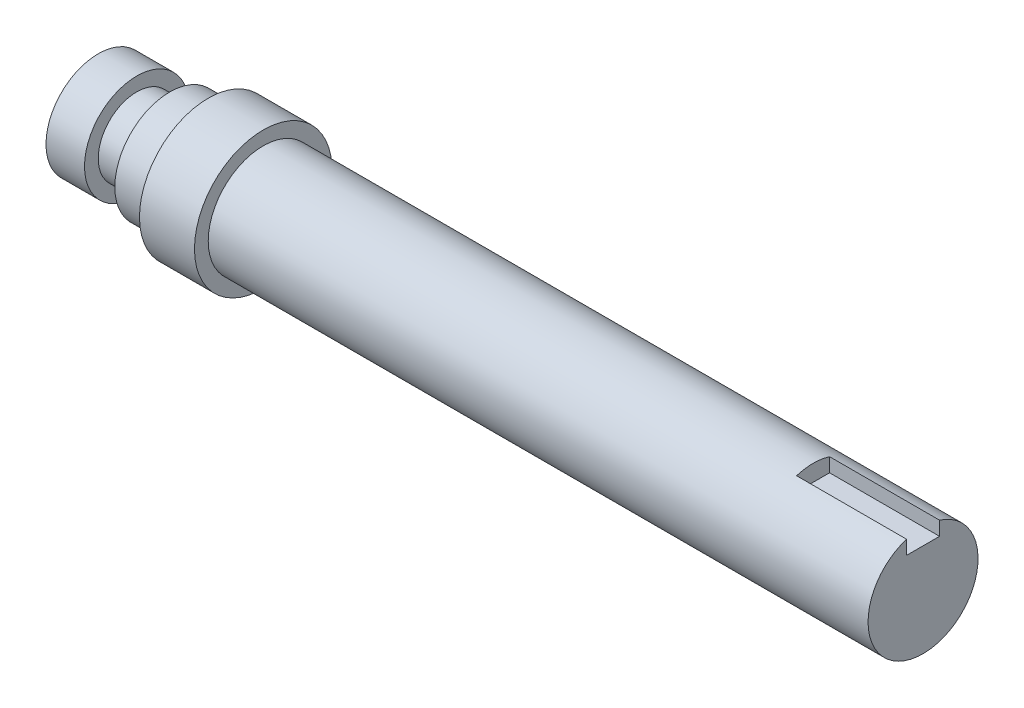
from build123d import *

# Parameters (mm, degrees)
SKETCH2_W          = 20
SKETCH2_H          = 5
CUT_EXTRUDE1_DEPTH = 3


with BuildPart() as part:
    # Sketch1 → Revolve1 (revolve)
    with BuildSketch(Plane.XY, mode=Mode.PRIVATE) as revolve1_sk:
        Polygon((0, 0), (0, 10), (-120, 10), (-120, 12.5), (-130, 12.5), (-130, 9.979591837), (-137, 9.979591837), (-137, 7), (-143, 7), (-143, 9.5), (-150, 9.5), (-150, 0), align=None)
    revolve(revolve1_sk.sketch.rotate(Axis((-150, 0, 0), (1, 0, 0)), 90), axis=Axis((-150, 0, 0), (1, 0, 0)))

    # Sketch2 → Cut-Extrude1 (cut, symmetric)
    with BuildSketch(Plane.XY):
        with Locations((-10, 9.5)):
            Rectangle(SKETCH2_W, SKETCH2_H)
    extrude(amount=CUT_EXTRUDE1_DEPTH, both=True, mode=Mode.SUBTRACT)


solid = part.part
